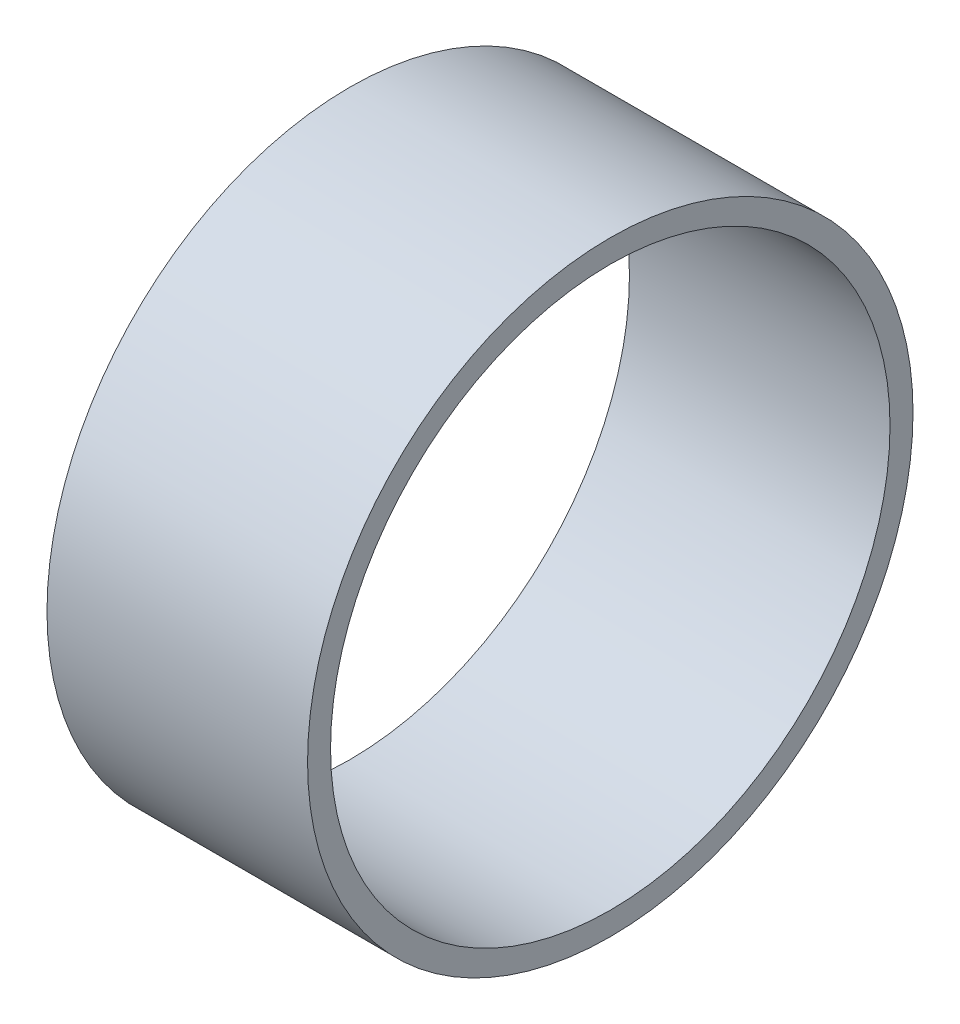
from build123d import *

# Parameters (mm, degrees)
SKETCH1_R           = 19.75
SKETCH1_R_2         = 18.25
BOSS_EXTRUDE1_DEPTH = 17


with BuildPart() as part:
    # Sketch1 → Boss-Extrude1 (new body)
    with BuildSketch(Plane(origin=(0, 0, 0), x_dir=(0, 0, -1), z_dir=(1, 0, 0))):
        Circle(SKETCH1_R)
        Circle(SKETCH1_R_2, mode=Mode.SUBTRACT)
    extrude(amount=BOSS_EXTRUDE1_DEPTH)


solid = part.part
